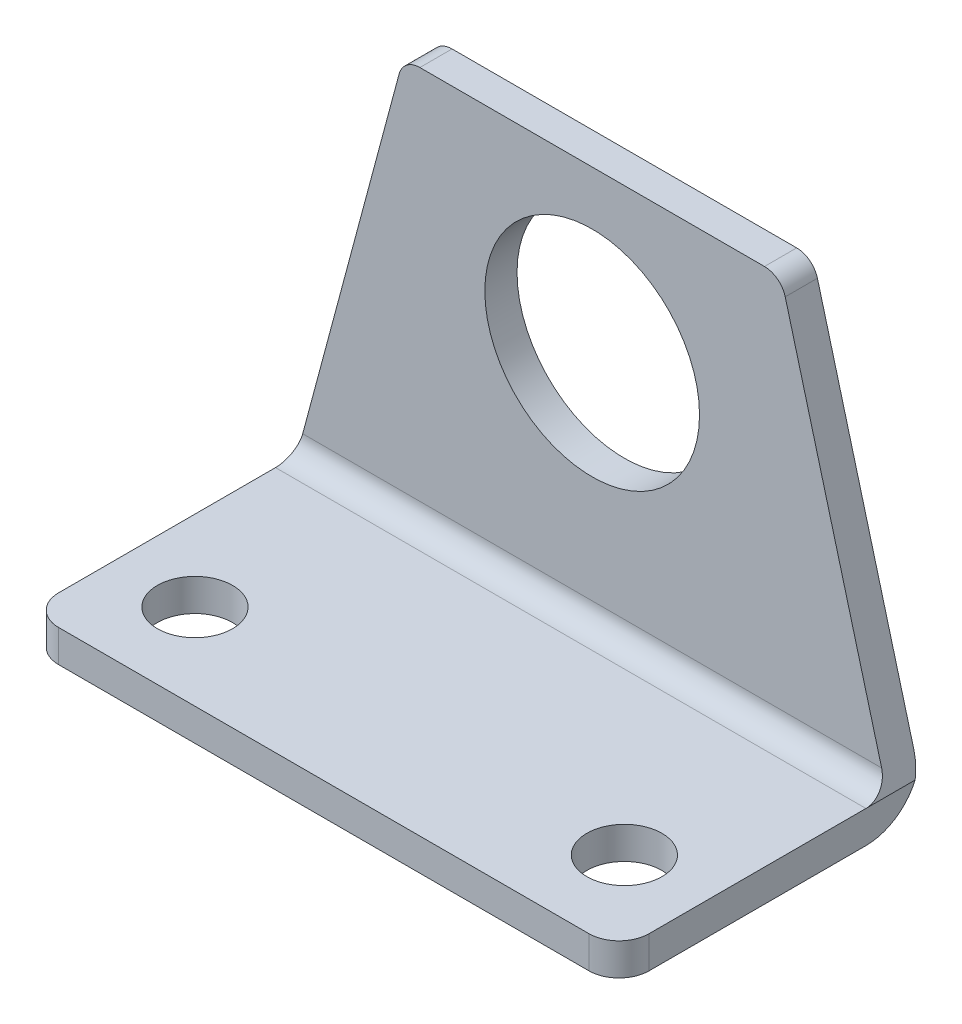
from build123d import *

# Parameters (mm, degrees)
EXTRUDE_START            = 27.5
EXTRUDE_1_DEPTH          = 55
SKETCH_4_R               = 10
CUT_EXTRUDE_1_DEPTH      = 55.60082417
CUT_EXTRUDE_2_DEPTH      = 55.60082417
CUT_EXTRUDE_2_DEPTH_BACK = 55.60082417
SKETCH_6_R               = 3.5
CUT_EXTRUDE_3_DEPTH      = 54.937463789
FILLET_1_R               = 2
FILLET_2_R               = 2.8


with BuildPart() as part:
    # 草图3 → 凸台-拉伸1 (new body)
    with BuildSketch(Plane(origin=(0, 0, 0), x_dir=(0, 0, -1), z_dir=(1, 0, 0)).offset(EXTRUDE_START)):
        with BuildLine():
            Line((-28, 0), (-5, 0))
            ThreePointArc((-5, 0), (-1.464466094, 1.464466094), (0, 5))
            Line((0, 5), (0, 40))
            Line((0, 40), (-3, 40))
            Line((-3, 40), (-3, 5))
            ThreePointArc((-3, 5), (-3.585786438, 3.585786438), (-5, 3))
            Line((-5, 3), (-28, 3))
            Line((-28, 3), (-28, 0))
        make_face()
    extrude(amount=-EXTRUDE_1_DEPTH)

    # 草图4 → 切除-拉伸1 (cut, through all)
    with BuildSketch(Plane.XY.offset(3)):
        with Locations((0, 25)):
            Circle(SKETCH_4_R)
    extrude(amount=-CUT_EXTRUDE_1_DEPTH, mode=Mode.SUBTRACT)

    # 草图5 → 切除-拉伸2 (cut, two sides: drawn at the far end of the back side and taken through both)
    with BuildSketch(Plane.XY.offset(3).offset(-CUT_EXTRUDE_2_DEPTH_BACK)):
        Polygon((-17.58587988, 40), (-27.5, 3), (-27.5, 50), (27.5, 50), (27.5, 3), (17.58587988, 40), align=None)
    extrude(amount=CUT_EXTRUDE_2_DEPTH + CUT_EXTRUDE_2_DEPTH_BACK, mode=Mode.SUBTRACT)

    # 草图6 → 切除-拉伸3 (cut, through all)
    with BuildSketch(Plane(origin=(0, 3, 0), x_dir=(1, 0, 0), z_dir=(0, 1, 0))):
        with Locations(Location((-20, -20, 0), (0, 0, 270))):
            Circle(SKETCH_6_R)
        with Locations(Location((20, -20, 0), (0, 0, 90))):
            Circle(SKETCH_6_R)
    extrude(amount=-CUT_EXTRUDE_3_DEPTH, mode=Mode.SUBTRACT)

    # 圆角1
    fillet_1_edges = [part.edges().sort_by_distance(p)[0] for p in [
        (17.58587988, 40, 1.5),
        (-17.58587988, 40, 1.5),
    ]]
    fillet(fillet_1_edges, radius=FILLET_1_R)

    # 圆角2
    fillet_2_edges = [part.edges().sort_by_distance(p)[0] for p in [
        (27.5, 1.5, 28),
        (-27.5, 1.5, 28),
    ]]
    fillet(fillet_2_edges, radius=FILLET_2_R)


solid = part.part
